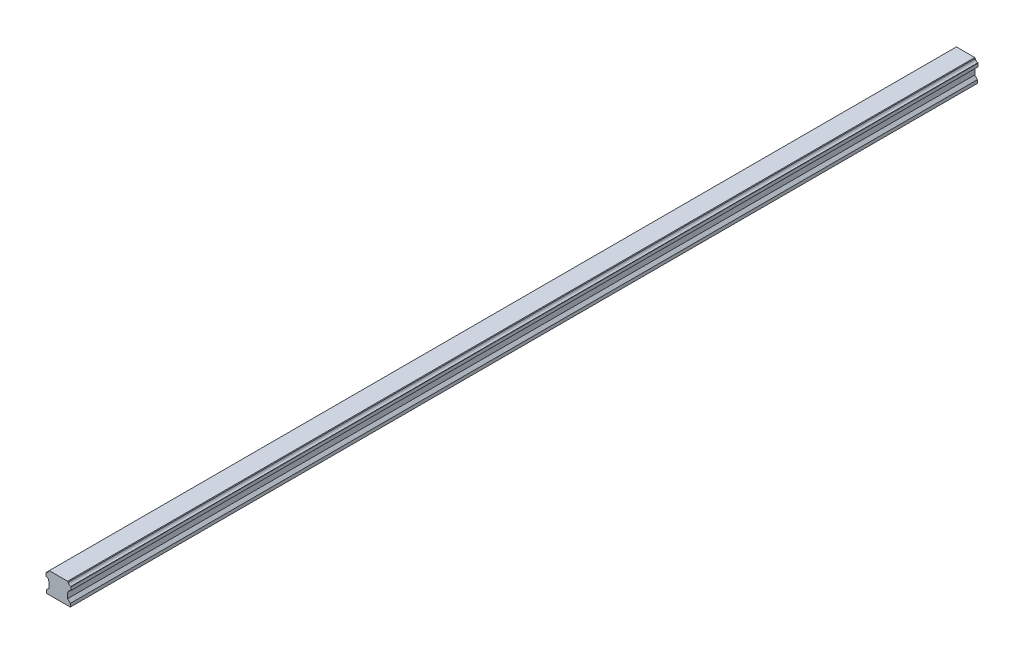
from build123d import *

# Parameters (mm, degrees)
ESTRUSIONE_ESTRUSIONE1_DEPTH = 400


with BuildPart() as part:
    # Schizzo1 → Estrusione-Estrusione1 (new body)
    with BuildSketch(Plane.XY):
        with BuildLine():
            Line((-4.767244197, -7.758332568), (-3.57557753, -6.566665902))
            Line((-3.57557753, -6.566665902), (-3.57557753, -4.183332568))
            Line((-3.57557753, -4.183332568), (-3.817526183, -3.941383916))
            ThreePointArc((-3.817526183, -3.941383916), (-4.162941949, -3.191503071), (-4.912822794, -2.846087304))
            Line((-4.912822794, -2.846087304), (-5.00557753, -2.753332568))
            Line((-5.00557753, -2.753332568), (-5.00557753, -1.323332568))
            Line((-5.00557753, -1.323332568), (-4.912822794, -1.230577833))
            ThreePointArc((-4.912822794, -1.230577833), (-4.162941949, -0.885162066), (-3.817526183, -0.135281221))
            Line((-3.817526183, -0.135281221), (-3.57557753, 0.106667432))
            Line((-3.57557753, 0.106667432), (4.527755803, 0.106667432))
            Line((4.527755803, 0.106667432), (4.769704456, -0.135281221))
            ThreePointArc((4.769704456, -0.135281221), (5.115120222, -0.885162066), (5.865001067, -1.230577833))
            Line((5.865001067, -1.230577833), (5.957755803, -1.323332568))
            Line((5.957755803, -1.323332568), (5.957755803, -2.753332568))
            Line((5.957755803, -2.753332568), (5.865001067, -2.846087304))
            ThreePointArc((5.865001067, -2.846087304), (5.115120222, -3.191503071), (4.769704456, -3.941383916))
            Line((4.769704456, -3.941383916), (4.527755803, -4.183332568))
            Line((4.527755803, -4.183332568), (4.527755803, -6.566665902))
            Line((4.527755803, -6.566665902), (5.71942247, -7.758332568))
            Line((5.71942247, -7.758332568), (5.71942247, -9.188332568))
            Line((5.71942247, -9.188332568), (-4.767244197, -9.188332568))
            Line((-4.767244197, -9.188332568), (-4.767244197, -7.758332568))
        make_face()
    extrude(amount=ESTRUSIONE_ESTRUSIONE1_DEPTH)


solid = part.part
